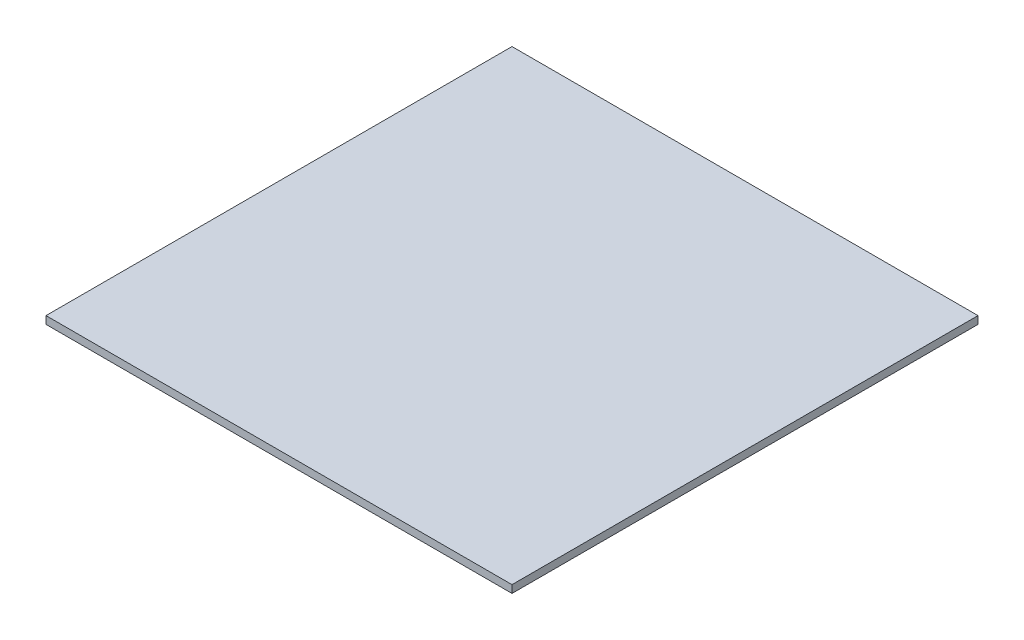
from build123d import *

# Parameters (mm, degrees)
SKETCH1_W           = 1220
SKETCH1_H           = 1220
BOSS_EXTRUDE1_DEPTH = 20


with BuildPart() as part:
    # Sketch1 → Boss-Extrude1 (new body)
    with BuildSketch(Plane(origin=(0, 0, 0), x_dir=(1, 0, 0), z_dir=(0, 1, 0))):
        Rectangle(SKETCH1_W, SKETCH1_H)
    extrude(amount=BOSS_EXTRUDE1_DEPTH)


solid = part.part
